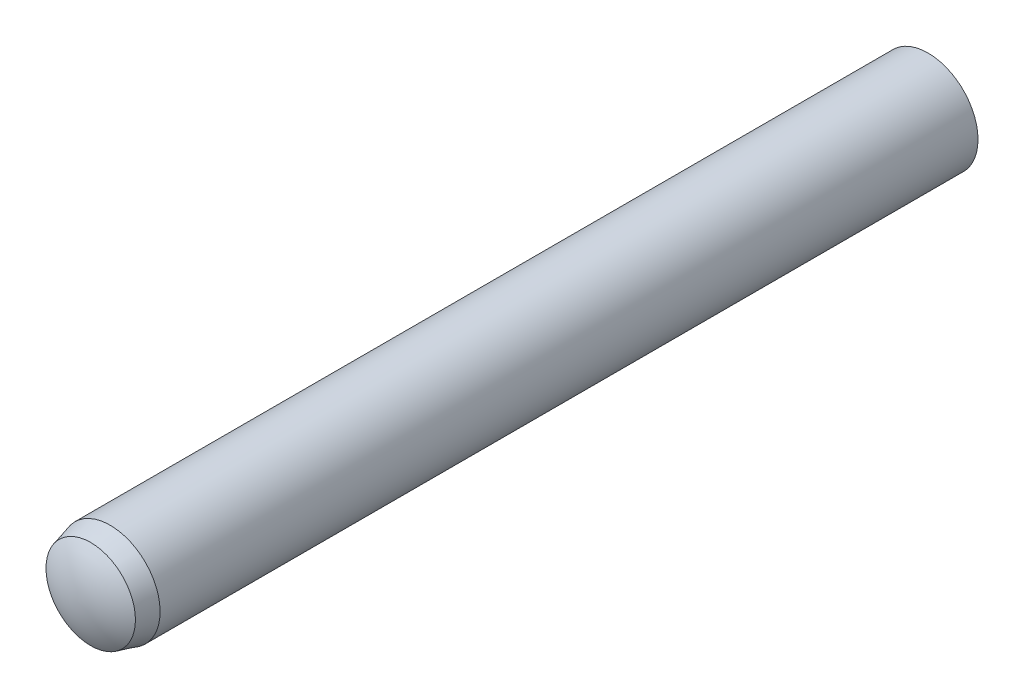
from build123d import *


with BuildPart() as part:
    # Sketch3 → Revolve1 (revolve)
    with BuildSketch(Plane(origin=(0, 0, 0), x_dir=(0, 0, -1), z_dir=(1, 0, 0))):
        with BuildLine():
            Line((-13, 0), (13, 0))
            ThreePointArc((13, 0), (12.885076627, 0.783022988), (12.55, 1.5))
            Line((12.55, 1.5), (-12.025, 1.5))
            Line((-12.025, 1.5), (-12.61, 1.343249722))
            ThreePointArc((-12.61, 1.343249722), (-12.90052754, 0.699360389), (-13, 0))
        make_face()
    revolve(axis=Axis((0, 0, 13), (0, 0, -1)))


solid = part.part
